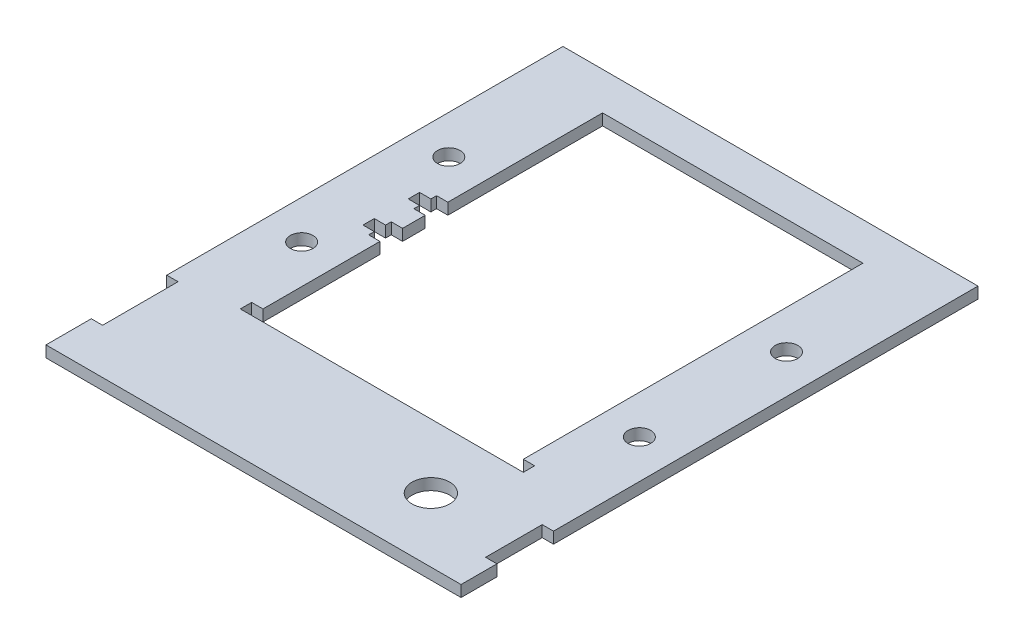
from build123d import *

# Parameters (mm, degrees)
CROQUIS1_R              = 3
CROQUIS1_R_2            = 5
SALIENTE_EXTRUIR1_DEPTH = 3


with BuildPart() as part:
    # Croquis1 → Saliente-Extruir1 (new body)
    with BuildSketch(Plane(origin=(0, 0, 0), x_dir=(1, 0, 0), z_dir=(0, 1, 0))):
        Polygon((0, 3), (110, 3), (110, 12.5), (107, 12.5), (107, 20), (107, 27.5), (110, 27.5), (110, 37), (110, 140), (89.5, 140), (20.5, 140), (0, 140), (0, 50), (0, 35), (3, 35), (3, 20), (3, 15), (0, 15), align=None)
        with Locations(Location((10.25, 60.5, 0), (0, 0, 270))):
            Circle(CROQUIS1_R, mode=Mode.SUBTRACT)
        with Locations(Location((85, 20, 0), (0, 0, 270))):
            Circle(CROQUIS1_R_2, mode=Mode.SUBTRACT)
        with Locations(Location((99.75, 60.5, 0), (0, 0, 270))):
            Circle(CROQUIS1_R, mode=Mode.SUBTRACT)
        with Locations(Location((10.25, 99.5, 0), (0, 0, 270))):
            Circle(CROQUIS1_R, mode=Mode.SUBTRACT)
        Polygon((92.5, 37), (89.5, 37), (20.5, 37), (17.5, 37), (17.5, 40), (20.5, 40), (20.5, 71), (17.5, 71), (17.5, 72.5), (14.5, 72.5), (14.5, 75.5), (17.5, 75.5), (17.5, 77), (20.5, 77), (20.5, 83), (17.5, 83), (17.5, 84.5), (14.5, 84.5), (14.5, 87.5), (17.5, 87.5), (17.5, 89), (20.5, 89), (20.5, 130), (89.5, 130), (89.5, 89), (89.5, 71), (89.5, 40), (92.5, 40), align=None, mode=Mode.SUBTRACT)
        with Locations(Location((99.75, 99.5, 0), (0, 0, 270))):
            Circle(CROQUIS1_R, mode=Mode.SUBTRACT)
    extrude(amount=SALIENTE_EXTRUIR1_DEPTH)


solid = part.part
